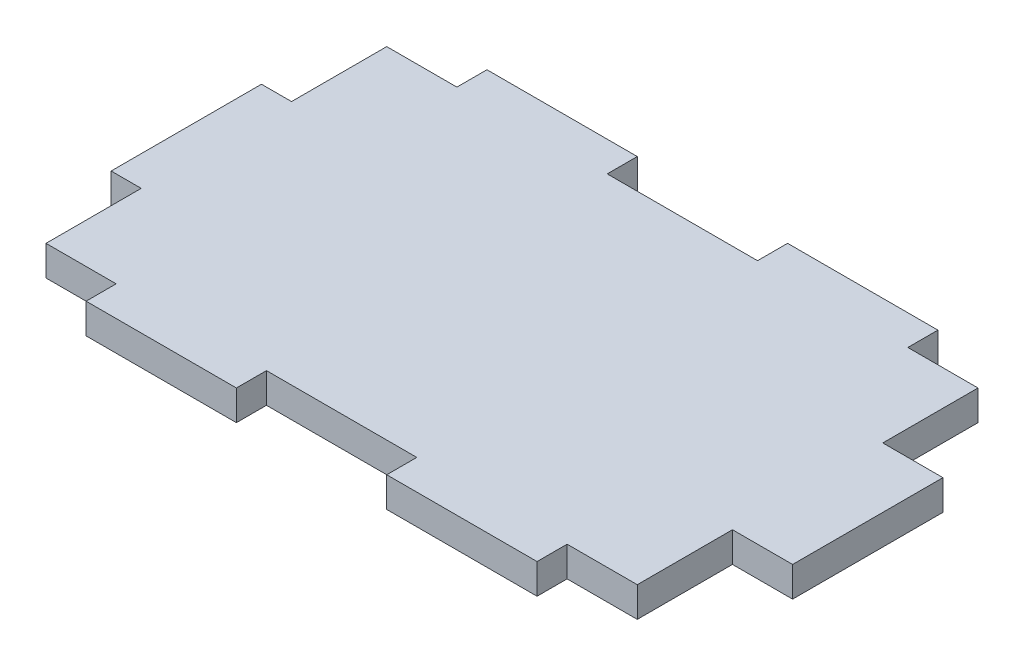
from build123d import *

# Parameters (mm, degrees)
SALIENTE_EXTRUIR1_DEPTH = 3


with BuildPart() as part:
    # Croquis1 → Saliente-Extruir1 (new body)
    with BuildSketch(Plane(origin=(0, 0, 0), x_dir=(1, 0, 0), z_dir=(0, 1, 0))):
        Polygon((55, 0), (55, 3), (62, 3), (62, 12.5), (68, 12.5), (68, 27.5), (62, 27.5), (62, 37), (55, 37), (55, 40), (40, 40), (40, 37), (25, 37), (25, 40), (10, 40), (10, 37), (3, 37), (3, 27.5), (0, 27.5), (0, 12.5), (3, 12.5), (3, 3), (10, 3), (10, 0), (25, 0), (25, 3), (40, 3), (40, 0), align=None)
    extrude(amount=SALIENTE_EXTRUIR1_DEPTH)


solid = part.part
